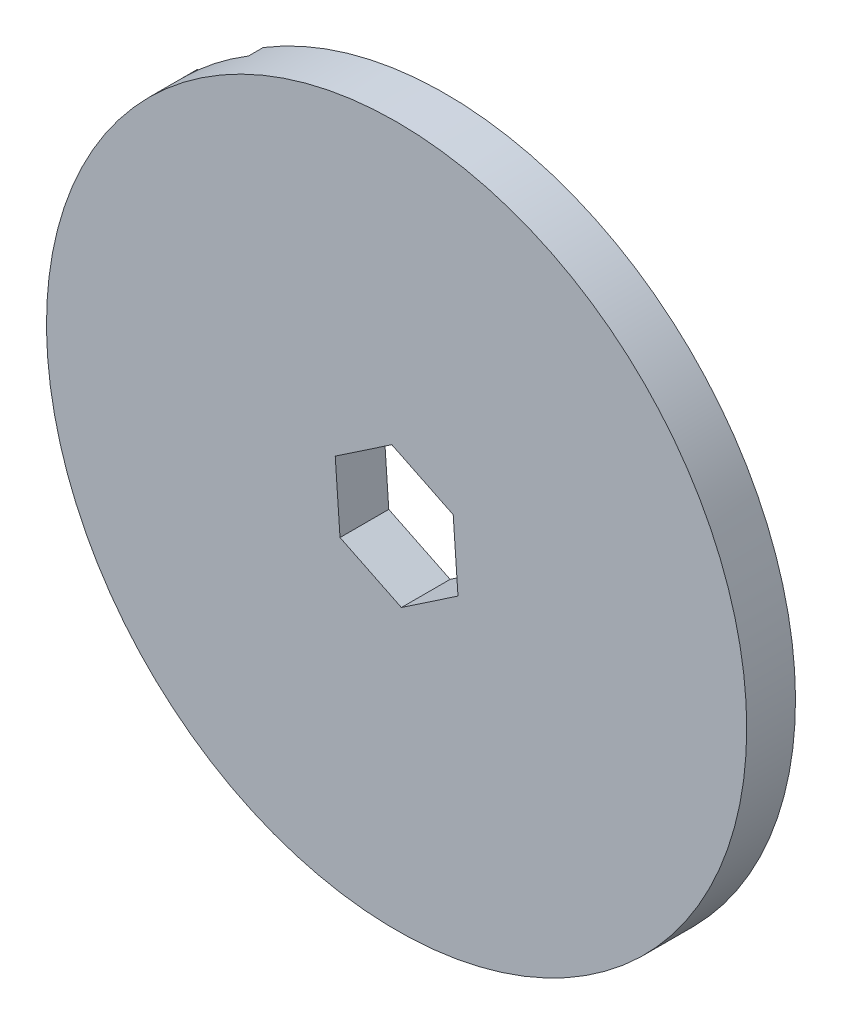
from build123d import *

# Parameters (mm, degrees)
SKETCH_1_R               = 35.9
EXTRUDE_1_DEPTH          = 5
CUT_EXTRUDE_1_DEPTH      = 1.5
PATTERN_CIRCULAR_1_COUNT = 2


with BuildPart() as part:
    # 草图1 → 凸台-拉伸1 (new body)
    with BuildSketch(Plane.XY):
        Circle(SKETCH_1_R)
        Polygon((6.292659869, -3.066338496), (5.801856968, 3.916434056), (-0.490802901, 6.982772552), (-6.292659869, 3.066338496), (-5.801856968, -3.916434056), (0.490802901, -6.982772552), align=None, mode=Mode.SUBTRACT)
    extrude(amount=EXTRUDE_1_DEPTH)

    # 草图2 → 切除-拉伸1 (cut)
    with BuildSketch(Plane(origin=(0, 0, 0), x_dir=(-1, 0, 0), z_dir=(0, 0, -1))):
        with BuildLine():
            Line((18.682261423, 30.655882113), (15.242196262, 25.839416656))
            ThreePointArc((15.242196262, 25.839416656), (18.484517825, 23.628851025), (21.410564164, 21.013989202))
            Line((21.410564164, 21.013989202), (25.403819071, 25.366434054))
            ThreePointArc((25.403819071, 25.366434054), (22.201130343, 28.21205082), (18.682261423, 30.655882113))
        make_face()
    cut_extrude_1 = extrude(amount=-CUT_EXTRUDE_1_DEPTH, mode=Mode.SUBTRACT)

    # 阵列(圆周)1: 切除-拉伸1 ×2 about axis
    pattern_circular_1_axis = Axis((0, 0, 0), (0, 0, 1))
    for i in range(1, PATTERN_CIRCULAR_1_COUNT):
        add(cut_extrude_1.rotate(pattern_circular_1_axis, i * 360 / PATTERN_CIRCULAR_1_COUNT), mode=Mode.SUBTRACT)


solid = part.part
